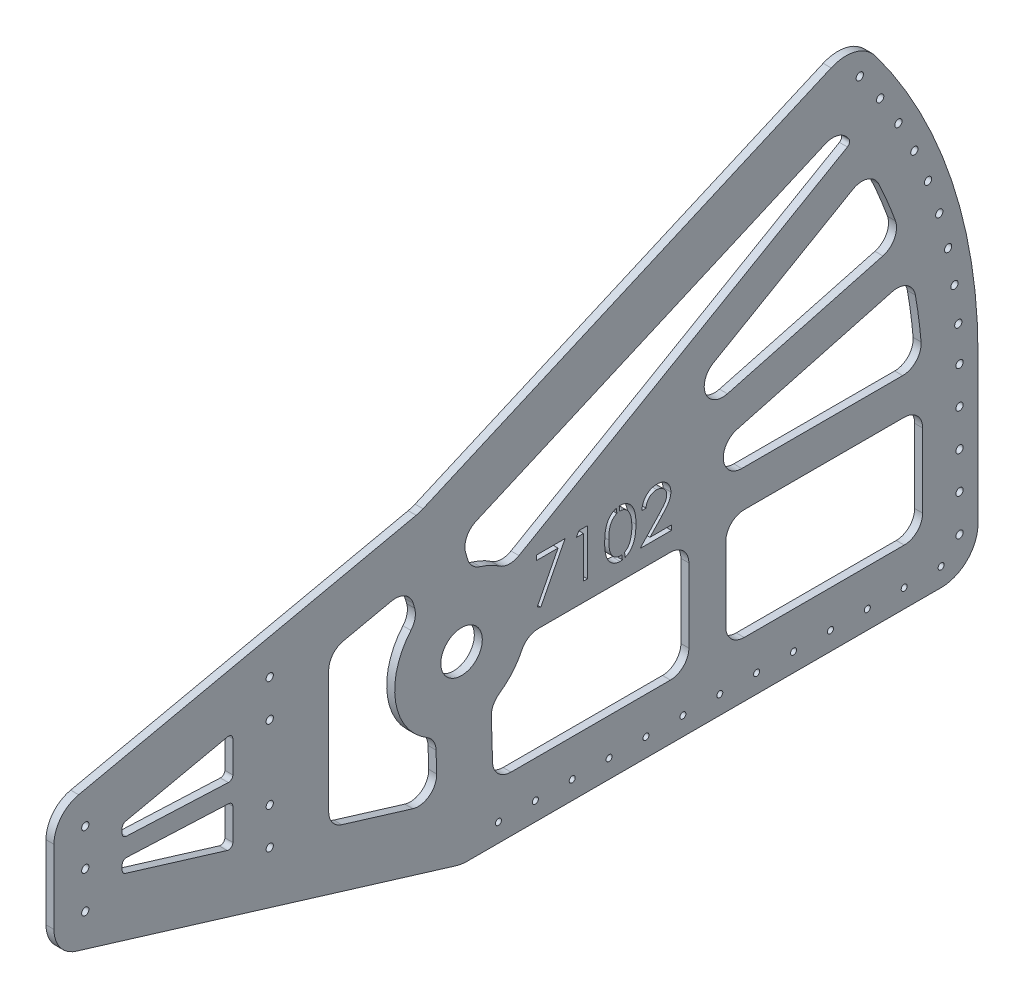
from build123d import *

# Parameters (mm, degrees)
SKETCH1_R               = 46.101
SKETCH1_R_2             = 9.906
SKETCH1_R_3             = 3.96875
SKETCH1_R_4             = 101.6
SKETCH1_R_5             = 14.2875
BOSS_EXTRUDE1_DEPTH     = 2.75
CUT_EXTRUDE1_REACH      = 424.776
SKETCH2_R               = 2.07
CUT_EXTRUDE2_REACH      = 424.776
SKETCH3_R               = 2.5
SKETCH4_R               = 2.5
BOSS_EXTRUDE2_DEPTH     = 5.5
CUT_EXTRUDE3_REACH      = 424.776
SKETCH4_2_R             = 2.5
CUT_EXTRUDE4_REACH      = 424.776
SKETCH5_R               = 2.5
FILLET1_R               = 25.4
CUT_EXTRUDE7_DEPTH      = 420.727841753
FILLET2_R               = 12.7
BOSS_EXTRUDE3_DEPTH     = 5.5
FILLET3_R               = 12.7
FILLET4_R               = 3.000000096
CUT_EXTRUDE8_DEPTH      = 420.727841892
CUT_EXTRUDE8_DEPTH_BACK = 420.727841892
BOSS_EXTRUDE4_DEPTH     = 5.5
SKETCH14_R              = 29.36875
BOSS_EXTRUDE6_DEPTH     = 5.5
CUT_EXTRUDE9_DEPTH      = 420.727841892
CUT_EXTRUDE9_DEPTH_BACK = 420.727841892
FILLET5_R               = 3.000000096


with BuildPart() as part:
    # Sketch1 → Boss-Extrude1 (new, symmetric)
    # profile 1 of 5: a face of its own
    with BuildSketch(Plane(origin=(0, 0, 0), x_dir=(0, 0, -1), z_dir=(1, 0, 0))):
        with Locations((-195.58, 0)):
            Circle(SKETCH1_R)
        with Locations((-195.58, 0)):
            Circle(SKETCH1_R_2, mode=Mode.SUBTRACT)
        with Locations((-195.58, 25.4)):
            Circle(SKETCH1_R_3, mode=Mode.SUBTRACT)
        with Locations((-170.18, 0)):
            Circle(SKETCH1_R_3, mode=Mode.SUBTRACT)
        with Locations((-195.58, -25.4)):
            Circle(SKETCH1_R_3, mode=Mode.SUBTRACT)
        with Locations((-220.98, 0)):
            Circle(SKETCH1_R_3, mode=Mode.SUBTRACT)
    # profile 2 of 5: a face of its own
    with BuildSketch(Plane(origin=(0, 0, 0), x_dir=(0, 0, -1), z_dir=(1, 0, 0))):
        with BuildLine():
            Line((-28.830649351, 97.423578553), (-208.661907143, 44.205948768))
            ThreePointArc((-208.661907143, 44.205948768), (-167.991839498, 36.935018629), (-149.479, 0))
            ThreePointArc((-149.479, 0), (-169.665960898, -38.128267446), (-212.547687379, -42.864901563))
            Line((-212.547687379, -42.864901563), (0, -127))
            Line((0, -127), (304.8, -127))
            ThreePointArc((304.8, -127), (325.816302934, 53.626269144), (248.018149992, 217.988617304))
            Line((248.018149992, 217.988617304), (-28.830649351, 97.423578553))
        make_face()
        with BuildLine():
            ThreePointArc((101.6, 0), (-60.800353724, -81.399490091), (-28.830649351, 97.423578553))
            ThreePointArc((-28.830649351, 97.423578553), (60.800353724, 81.399490091), (101.6, 0))
        make_face(mode=Mode.SUBTRACT)
    # profile 3 of 5: a face of its own
    with BuildSketch(Plane(origin=(0, 0, 0), x_dir=(0, 0, -1), z_dir=(1, 0, 0))):
        Circle(SKETCH1_R_4)
        Circle(SKETCH1_R_5, mode=Mode.SUBTRACT)
    # profile 4 of 5: a face of its own
    with BuildSketch(Plane(origin=(0, 0, 0), x_dir=(0, 0, -1), z_dir=(1, 0, 0))):
        with BuildLine():
            Line((260.222792238, 223.303623795), (248.018149992, 217.988617304))
            ThreePointArc((248.018149992, 217.988617304), (325.816302934, 53.626269144), (304.8, -127))
            Line((304.8, -127), (318.514379581, -127))
            ThreePointArc((318.514379581, -127), (338.248925678, 56.28564895), (260.222792238, 223.303623795))
        make_face()
    # profile 5 of 5: a face of its own
    with BuildSketch(Plane(origin=(0, 0, 0), x_dir=(0, 0, -1), z_dir=(1, 0, 0))):
        with BuildLine():
            Line((272.384654487, 228.6), (260.222792238, 223.303623795))
            ThreePointArc((260.222792238, 223.303623795), (338.248925678, 56.28564895), (318.514379581, -127))
            Line((318.514379581, -127), (355.6, -127))
            Line((355.6, -127), (355.6, 0))
            ThreePointArc((355.6, 0), (334.14917562, 121.637528881), (272.384654487, 228.6))
        make_face()
    extrude(amount=BOSS_EXTRUDE1_DEPTH, both=True)

    # Sketch2 → Cut-Extrude1 (cut, up to next)
    with BuildSketch(Plane(origin=(2.75, 0, 0), x_dir=(0, 0, -1), z_dir=(1, 0, 0)), mode=Mode.PRIVATE) as cut_extrude1_sk1:
        with Locations((330.2, -114.3)):
            Circle(SKETCH2_R)
    cut_extrude1_tool1 = extrude(cut_extrude1_sk1.sketch, amount=-CUT_EXTRUDE1_REACH, mode=Mode.PRIVATE) & part.part
    # Sketch2 → Cut-Extrude1 (cut, up to next)
    with BuildSketch(Plane(origin=(2.75, 0, 0), x_dir=(0, 0, -1), z_dir=(1, 0, 0)), mode=Mode.PRIVATE) as cut_extrude1_sk2:
        with Locations((304.8, -114.3)):
            Circle(SKETCH2_R)
    cut_extrude1_tool2 = extrude(cut_extrude1_sk2.sketch, amount=-CUT_EXTRUDE1_REACH, mode=Mode.PRIVATE) & part.part
    # Sketch2 → Cut-Extrude1 (cut, up to next)
    with BuildSketch(Plane(origin=(2.75, 0, 0), x_dir=(0, 0, -1), z_dir=(1, 0, 0)), mode=Mode.PRIVATE) as cut_extrude1_sk3:
        with Locations((279.4, -114.3)):
            Circle(SKETCH2_R)
    cut_extrude1_tool3 = extrude(cut_extrude1_sk3.sketch, amount=-CUT_EXTRUDE1_REACH, mode=Mode.PRIVATE) & part.part
    # Sketch2 → Cut-Extrude1 (cut, up to next)
    with BuildSketch(Plane(origin=(2.75, 0, 0), x_dir=(0, 0, -1), z_dir=(1, 0, 0)), mode=Mode.PRIVATE) as cut_extrude1_sk4:
        with Locations((254, -114.3)):
            Circle(SKETCH2_R)
    cut_extrude1_tool4 = extrude(cut_extrude1_sk4.sketch, amount=-CUT_EXTRUDE1_REACH, mode=Mode.PRIVATE) & part.part
    # Sketch2 → Cut-Extrude1 (cut, up to next)
    with BuildSketch(Plane(origin=(2.75, 0, 0), x_dir=(0, 0, -1), z_dir=(1, 0, 0)), mode=Mode.PRIVATE) as cut_extrude1_sk5:
        with Locations((228.6, -114.3)):
            Circle(SKETCH2_R)
    cut_extrude1_tool5 = extrude(cut_extrude1_sk5.sketch, amount=-CUT_EXTRUDE1_REACH, mode=Mode.PRIVATE) & part.part
    # Sketch2 → Cut-Extrude1 (cut, up to next)
    with BuildSketch(Plane(origin=(2.75, 0, 0), x_dir=(0, 0, -1), z_dir=(1, 0, 0)), mode=Mode.PRIVATE) as cut_extrude1_sk6:
        with Locations((203.2, -114.3)):
            Circle(SKETCH2_R)
    cut_extrude1_tool6 = extrude(cut_extrude1_sk6.sketch, amount=-CUT_EXTRUDE1_REACH, mode=Mode.PRIVATE) & part.part
    # Sketch2 → Cut-Extrude1 (cut, up to next)
    with BuildSketch(Plane(origin=(2.75, 0, 0), x_dir=(0, 0, -1), z_dir=(1, 0, 0)), mode=Mode.PRIVATE) as cut_extrude1_sk7:
        with Locations((177.8, -114.3)):
            Circle(SKETCH2_R)
    cut_extrude1_tool7 = extrude(cut_extrude1_sk7.sketch, amount=-CUT_EXTRUDE1_REACH, mode=Mode.PRIVATE) & part.part
    # Sketch2 → Cut-Extrude1 (cut, up to next)
    with BuildSketch(Plane(origin=(2.75, 0, 0), x_dir=(0, 0, -1), z_dir=(1, 0, 0)), mode=Mode.PRIVATE) as cut_extrude1_sk8:
        with Locations((152.4, -114.3)):
            Circle(SKETCH2_R)
    cut_extrude1_tool8 = extrude(cut_extrude1_sk8.sketch, amount=-CUT_EXTRUDE1_REACH, mode=Mode.PRIVATE) & part.part
    # Sketch2 → Cut-Extrude1 (cut, up to next)
    with BuildSketch(Plane(origin=(2.75, 0, 0), x_dir=(0, 0, -1), z_dir=(1, 0, 0)), mode=Mode.PRIVATE) as cut_extrude1_sk9:
        with Locations((127, -114.3)):
            Circle(SKETCH2_R)
    cut_extrude1_tool9 = extrude(cut_extrude1_sk9.sketch, amount=-CUT_EXTRUDE1_REACH, mode=Mode.PRIVATE) & part.part
    # Sketch2 → Cut-Extrude1 (cut, up to next)
    with BuildSketch(Plane(origin=(2.75, 0, 0), x_dir=(0, 0, -1), z_dir=(1, 0, 0)), mode=Mode.PRIVATE) as cut_extrude1_sk10:
        with Locations((101.6, -114.3)):
            Circle(SKETCH2_R)
    cut_extrude1_tool10 = extrude(cut_extrude1_sk10.sketch, amount=-CUT_EXTRUDE1_REACH, mode=Mode.PRIVATE) & part.part
    # Sketch2 → Cut-Extrude1 (cut, up to next)
    with BuildSketch(Plane(origin=(2.75, 0, 0), x_dir=(0, 0, -1), z_dir=(1, 0, 0)), mode=Mode.PRIVATE) as cut_extrude1_sk11:
        with Locations((76.2, -114.3)):
            Circle(SKETCH2_R)
    cut_extrude1_tool11 = extrude(cut_extrude1_sk11.sketch, amount=-CUT_EXTRUDE1_REACH, mode=Mode.PRIVATE) & part.part
    # Sketch2 → Cut-Extrude1 (cut, up to next)
    with BuildSketch(Plane(origin=(2.75, 0, 0), x_dir=(0, 0, -1), z_dir=(1, 0, 0)), mode=Mode.PRIVATE) as cut_extrude1_sk12:
        with Locations((50.8, -114.3)):
            Circle(SKETCH2_R)
    cut_extrude1_tool12 = extrude(cut_extrude1_sk12.sketch, amount=-CUT_EXTRUDE1_REACH, mode=Mode.PRIVATE) & part.part
    # Sketch2 → Cut-Extrude1 (cut, up to next)
    with BuildSketch(Plane(origin=(2.75, 0, 0), x_dir=(0, 0, -1), z_dir=(1, 0, 0)), mode=Mode.PRIVATE) as cut_extrude1_sk13:
        with Locations((25.4, -114.3)):
            Circle(SKETCH2_R)
    cut_extrude1_tool13 = extrude(cut_extrude1_sk13.sketch, amount=-CUT_EXTRUDE1_REACH, mode=Mode.PRIVATE) & part.part
    add(cut_extrude1_tool1.solids().sort_by_distance((2.75, -114.3, -330.2))[0], mode=Mode.SUBTRACT)
    add(cut_extrude1_tool2.solids().sort_by_distance((2.75, -114.3, -304.8))[0], mode=Mode.SUBTRACT)
    add(cut_extrude1_tool3.solids().sort_by_distance((2.75, -114.3, -279.4))[0], mode=Mode.SUBTRACT)
    add(cut_extrude1_tool4.solids().sort_by_distance((2.75, -114.3, -254))[0], mode=Mode.SUBTRACT)
    add(cut_extrude1_tool5.solids().sort_by_distance((2.75, -114.3, -228.6))[0], mode=Mode.SUBTRACT)
    add(cut_extrude1_tool6.solids().sort_by_distance((2.75, -114.3, -203.2))[0], mode=Mode.SUBTRACT)
    add(cut_extrude1_tool7.solids().sort_by_distance((2.75, -114.3, -177.8))[0], mode=Mode.SUBTRACT)
    add(cut_extrude1_tool8.solids().sort_by_distance((2.75, -114.3, -152.4))[0], mode=Mode.SUBTRACT)
    add(cut_extrude1_tool9.solids().sort_by_distance((2.75, -114.3, -127))[0], mode=Mode.SUBTRACT)
    add(cut_extrude1_tool10.solids().sort_by_distance((2.75, -114.3, -101.6))[0], mode=Mode.SUBTRACT)
    add(cut_extrude1_tool11.solids().sort_by_distance((2.75, -114.3, -76.2))[0], mode=Mode.SUBTRACT)
    add(cut_extrude1_tool12.solids().sort_by_distance((2.75, -114.3, -50.8))[0], mode=Mode.SUBTRACT)
    add(cut_extrude1_tool13.solids().sort_by_distance((2.75, -114.3, -25.4))[0], mode=Mode.SUBTRACT)

    # Sketch3 → Cut-Extrude2 (cut, up to next)
    with BuildSketch(Plane(origin=(2.75, 0, 0), x_dir=(0, 0, -1), z_dir=(1, 0, 0)), mode=Mode.PRIVATE) as cut_extrude2_sk1:
        with Locations((342.9, 0)):
            Circle(SKETCH3_R)
    cut_extrude2_tool1 = extrude(cut_extrude2_sk1.sketch, amount=-CUT_EXTRUDE2_REACH, mode=Mode.PRIVATE) & part.part
    # Sketch3 → Cut-Extrude2 (cut, up to next)
    with BuildSketch(Plane(origin=(2.75, 0, 0), x_dir=(0, 0, -1), z_dir=(1, 0, 0)), mode=Mode.PRIVATE) as cut_extrude2_sk2:
        with Locations((342.022444467, 24.516473662)):
            Circle(SKETCH3_R)
    cut_extrude2_tool2 = extrude(cut_extrude2_sk2.sketch, amount=-CUT_EXTRUDE2_REACH, mode=Mode.PRIVATE) & part.part
    # Sketch3 → Cut-Extrude2 (cut, up to next)
    with BuildSketch(Plane(origin=(2.75, 0, 0), x_dir=(0, 0, -1), z_dir=(1, 0, 0)), mode=Mode.PRIVATE) as cut_extrude2_sk3:
        with Locations((339.394269578, 48.907461368)):
            Circle(SKETCH3_R)
    cut_extrude2_tool3 = extrude(cut_extrude2_sk3.sketch, amount=-CUT_EXTRUDE2_REACH, mode=Mode.PRIVATE) & part.part
    # Sketch3 → Cut-Extrude2 (cut, up to next)
    with BuildSketch(Plane(origin=(2.75, 0, 0), x_dir=(0, 0, -1), z_dir=(1, 0, 0)), mode=Mode.PRIVATE) as cut_extrude2_sk4:
        with Locations((335.028927474, 73.048119454)):
            Circle(SKETCH3_R)
    cut_extrude2_tool4 = extrude(cut_extrude2_sk4.sketch, amount=-CUT_EXTRUDE2_REACH, mode=Mode.PRIVATE) & part.part
    # Sketch3 → Cut-Extrude2 (cut, up to next)
    with BuildSketch(Plane(origin=(2.75, 0, 0), x_dir=(0, 0, -1), z_dir=(1, 0, 0)), mode=Mode.PRIVATE) as cut_extrude2_sk5:
        with Locations((328.94876187, 96.814885551)):
            Circle(SKETCH3_R)
    cut_extrude2_tool5 = extrude(cut_extrude2_sk5.sketch, amount=-CUT_EXTRUDE2_REACH, mode=Mode.PRIVATE) & part.part
    # Sketch3 → Cut-Extrude2 (cut, up to next)
    with BuildSketch(Plane(origin=(2.75, 0, 0), x_dir=(0, 0, -1), z_dir=(1, 0, 0)), mode=Mode.PRIVATE) as cut_extrude2_sk6:
        with Locations((321.184893693, 120.086111034)):
            Circle(SKETCH3_R)
    cut_extrude2_tool6 = extrude(cut_extrude2_sk6.sketch, amount=-CUT_EXTRUDE2_REACH, mode=Mode.PRIVATE) & part.part
    # Sketch3 → Cut-Extrude2 (cut, up to next)
    with BuildSketch(Plane(origin=(2.75, 0, 0), x_dir=(0, 0, -1), z_dir=(1, 0, 0)), mode=Mode.PRIVATE) as cut_extrude2_sk7:
        with Locations((311.777061792, 142.742683666)):
            Circle(SKETCH3_R)
    cut_extrude2_tool7 = extrude(cut_extrude2_sk7.sketch, amount=-CUT_EXTRUDE2_REACH, mode=Mode.PRIVATE) & part.part
    # Sketch3 → Cut-Extrude2 (cut, up to next)
    with BuildSketch(Plane(origin=(2.75, 0, 0), x_dir=(0, 0, -1), z_dir=(1, 0, 0)), mode=Mode.PRIVATE) as cut_extrude2_sk8:
        with Locations((300.773419535, 164.668637273)):
            Circle(SKETCH3_R)
    cut_extrude2_tool8 = extrude(cut_extrude2_sk8.sketch, amount=-CUT_EXTRUDE2_REACH, mode=Mode.PRIVATE) & part.part
    # Sketch3 → Cut-Extrude2 (cut, up to next)
    with BuildSketch(Plane(origin=(2.75, 0, 0), x_dir=(0, 0, -1), z_dir=(1, 0, 0)), mode=Mode.PRIVATE) as cut_extrude2_sk9:
        with Locations((288.230288339, 185.751745306)):
            Circle(SKETCH3_R)
    cut_extrude2_tool9 = extrude(cut_extrude2_sk9.sketch, amount=-CUT_EXTRUDE2_REACH, mode=Mode.PRIVATE) & part.part
    # Sketch3 → Cut-Extrude2 (cut, up to next)
    with BuildSketch(Plane(origin=(2.75, 0, 0), x_dir=(0, 0, -1), z_dir=(1, 0, 0)), mode=Mode.PRIVATE) as cut_extrude2_sk10:
        with Locations((274.211869395, 205.884095264)):
            Circle(SKETCH3_R)
    cut_extrude2_tool10 = extrude(cut_extrude2_sk10.sketch, amount=-CUT_EXTRUDE2_REACH, mode=Mode.PRIVATE) & part.part
    # Sketch3 → Cut-Extrude2 (cut, up to next)
    with BuildSketch(Plane(origin=(2.75, 0, 0), x_dir=(0, 0, -1), z_dir=(1, 0, 0)), mode=Mode.PRIVATE) as cut_extrude2_sk11:
        with Locations((342.9, -25.4)):
            Circle(SKETCH3_R)
    cut_extrude2_tool11 = extrude(cut_extrude2_sk11.sketch, amount=-CUT_EXTRUDE2_REACH, mode=Mode.PRIVATE) & part.part
    # Sketch3 → Cut-Extrude2 (cut, up to next)
    with BuildSketch(Plane(origin=(2.75, 0, 0), x_dir=(0, 0, -1), z_dir=(1, 0, 0)), mode=Mode.PRIVATE) as cut_extrude2_sk12:
        with Locations((342.9, -50.8)):
            Circle(SKETCH3_R)
    cut_extrude2_tool12 = extrude(cut_extrude2_sk12.sketch, amount=-CUT_EXTRUDE2_REACH, mode=Mode.PRIVATE) & part.part
    # Sketch3 → Cut-Extrude2 (cut, up to next)
    with BuildSketch(Plane(origin=(2.75, 0, 0), x_dir=(0, 0, -1), z_dir=(1, 0, 0)), mode=Mode.PRIVATE) as cut_extrude2_sk13:
        with Locations((342.9, -76.2)):
            Circle(SKETCH3_R)
    cut_extrude2_tool13 = extrude(cut_extrude2_sk13.sketch, amount=-CUT_EXTRUDE2_REACH, mode=Mode.PRIVATE) & part.part
    # Sketch3 → Cut-Extrude2 (cut, up to next)
    with BuildSketch(Plane(origin=(2.75, 0, 0), x_dir=(0, 0, -1), z_dir=(1, 0, 0)), mode=Mode.PRIVATE) as cut_extrude2_sk14:
        with Locations((342.9, -101.6)):
            Circle(SKETCH3_R)
    cut_extrude2_tool14 = extrude(cut_extrude2_sk14.sketch, amount=-CUT_EXTRUDE2_REACH, mode=Mode.PRIVATE) & part.part
    add(cut_extrude2_tool1.solids().sort_by_distance((2.75, 0, -342.9))[0], mode=Mode.SUBTRACT)
    add(cut_extrude2_tool2.solids().sort_by_distance((2.75, 24.516474, -342.022444))[0], mode=Mode.SUBTRACT)
    add(cut_extrude2_tool3.solids().sort_by_distance((2.75, 48.907461, -339.39427))[0], mode=Mode.SUBTRACT)
    add(cut_extrude2_tool4.solids().sort_by_distance((2.75, 73.048119, -335.028927))[0], mode=Mode.SUBTRACT)
    add(cut_extrude2_tool5.solids().sort_by_distance((2.75, 96.814886, -328.948762))[0], mode=Mode.SUBTRACT)
    add(cut_extrude2_tool6.solids().sort_by_distance((2.75, 120.086111, -321.184894))[0], mode=Mode.SUBTRACT)
    add(cut_extrude2_tool7.solids().sort_by_distance((2.75, 142.742684, -311.777062))[0], mode=Mode.SUBTRACT)
    add(cut_extrude2_tool8.solids().sort_by_distance((2.75, 164.668637, -300.77342))[0], mode=Mode.SUBTRACT)
    add(cut_extrude2_tool9.solids().sort_by_distance((2.75, 185.751745, -288.230288))[0], mode=Mode.SUBTRACT)
    add(cut_extrude2_tool10.solids().sort_by_distance((2.75, 205.884095, -274.211869))[0], mode=Mode.SUBTRACT)
    add(cut_extrude2_tool11.solids().sort_by_distance((2.75, -25.4, -342.9))[0], mode=Mode.SUBTRACT)
    add(cut_extrude2_tool12.solids().sort_by_distance((2.75, -50.8, -342.9))[0], mode=Mode.SUBTRACT)
    add(cut_extrude2_tool13.solids().sort_by_distance((2.75, -76.2, -342.9))[0], mode=Mode.SUBTRACT)
    add(cut_extrude2_tool14.solids().sort_by_distance((2.75, -101.6, -342.9))[0], mode=Mode.SUBTRACT)

    # Sketch4 → Boss-Extrude2 (add)
    # profile 1 of 4: a face of its own
    with BuildSketch(Plane(origin=(2.75, 0, 0), x_dir=(0, 0, -1), z_dir=(1, 0, 0))):
        with Locations((-132.08, 25.4)):
            Circle(SKETCH4_R)
    # profile 2 of 4: a face of its own
    with BuildSketch(Plane(origin=(2.75, 0, 0), x_dir=(0, 0, -1), z_dir=(1, 0, 0))):
        with Locations((-132.08, -25.4)):
            Circle(SKETCH4_R)
    # profile 3 of 4: a face of its own
    with BuildSketch(Plane(origin=(2.75, 0, 0), x_dir=(0, 0, -1), z_dir=(1, 0, 0))):
        with Locations((-132.08, 0)):
            Circle(SKETCH4_R)
    # profile 4 of 4: a face of its own
    with BuildSketch(Plane(origin=(2.75, 0, 0), x_dir=(0, 0, -1), z_dir=(1, 0, 0))):
        with BuildLine():
            Line((-280.63, 25.4), (-280.63, -25.4))
            ThreePointArc((-280.63, -25.4), (-276.399947897, -38.222710511), (-265.370426464, -46.011478232))
            Line((-265.370426464, -46.011478232), (0, -127))
            Line((0, -127), (-195.58, -49.581408647))
            Line((-195.58, -49.581408647), (-212.547687379, -42.864901563))
            ThreePointArc((-212.547687379, -42.864901563), (-241.635160157, 2.05534034), (-208.661907143, 44.205948768))
            Line((-208.661907143, 44.205948768), (-28.830649351, 97.423578553))
            Line((-28.830649351, 97.423578553), (-263.650668099, 46.45971256))
            ThreePointArc((-263.650668099, 46.45971256), (-275.856477544, 38.925986146), (-280.63, 25.4))
        make_face()
        with Locations((-259.08, -25.4)):
            Circle(SKETCH4_R, mode=Mode.SUBTRACT)
        with Locations((-259.08, 0)):
            Circle(SKETCH4_R, mode=Mode.SUBTRACT)
        with Locations((-259.08, 25.4)):
            Circle(SKETCH4_R, mode=Mode.SUBTRACT)
    extrude(amount=-BOSS_EXTRUDE2_DEPTH)

    # Sketch4<2> → Cut-Extrude3 (cut, up to next)
    with BuildSketch(Plane(origin=(2.75, 0, 0), x_dir=(0, 0, -1), z_dir=(1, 0, 0)), mode=Mode.PRIVATE) as cut_extrude3_sk1:
        with Locations((-132.08, 25.4)):
            Circle(SKETCH4_2_R)
    cut_extrude3_tool1 = extrude(cut_extrude3_sk1.sketch, amount=-CUT_EXTRUDE3_REACH, mode=Mode.PRIVATE) & part.part
    # Sketch4<2> → Cut-Extrude3 (cut, up to next)
    with BuildSketch(Plane(origin=(2.75, 0, 0), x_dir=(0, 0, -1), z_dir=(1, 0, 0)), mode=Mode.PRIVATE) as cut_extrude3_sk2:
        with Locations((-132.08, -25.4)):
            Circle(SKETCH4_2_R)
    cut_extrude3_tool2 = extrude(cut_extrude3_sk2.sketch, amount=-CUT_EXTRUDE3_REACH, mode=Mode.PRIVATE) & part.part
    add(cut_extrude3_tool1.solids().sort_by_distance((2.75, 25.4, 132.08))[0], mode=Mode.SUBTRACT)
    add(cut_extrude3_tool2.solids().sort_by_distance((2.75, -25.4, 132.08))[0], mode=Mode.SUBTRACT)

    # Sketch5 → Cut-Extrude4 (cut, up to next)
    with BuildSketch(Plane(origin=(2.75, 0, 0), x_dir=(0, 0, -1), z_dir=(1, 0, 0)), mode=Mode.PRIVATE) as cut_extrude4_sk1:
        with Locations((-132.08, 50.8)):
            Circle(SKETCH5_R)
    cut_extrude4_tool1 = extrude(cut_extrude4_sk1.sketch, amount=-CUT_EXTRUDE4_REACH, mode=Mode.PRIVATE) & part.part
    # Sketch5 → Cut-Extrude4 (cut, up to next)
    with BuildSketch(Plane(origin=(2.75, 0, 0), x_dir=(0, 0, -1), z_dir=(1, 0, 0)), mode=Mode.PRIVATE) as cut_extrude4_sk2:
        with Locations((-132.08, -50.8)):
            Circle(SKETCH5_R)
    cut_extrude4_tool2 = extrude(cut_extrude4_sk2.sketch, amount=-CUT_EXTRUDE4_REACH, mode=Mode.PRIVATE) & part.part
    add(cut_extrude4_tool1.solids().sort_by_distance((2.75, 50.8, 132.08))[0], mode=Mode.SUBTRACT)
    add(cut_extrude4_tool2.solids().sort_by_distance((2.75, -50.8, 132.08))[0], mode=Mode.SUBTRACT)

    # Fillet1
    fillet1_edges = [part.edges().sort_by_distance(p)[0] for p in [
        (0, 97.423578553, 28.830649351),
        (0, 228.6, -272.384654487),
        (0, -127, -355.6),
        (0, -127, 0),
    ]]
    fillet(fillet1_edges, radius=FILLET1_R)

    # Sketch9 → Cut-Extrude7 (cut, through all)
    with BuildSketch(Plane(origin=(2.75, 0, 0), x_dir=(0, 0, -1), z_dir=(1, 0, 0))):
        with BuildLine():
            Line((-36.659058041, 56.737550412), (-91.48, 44.839556559))
            Line((-91.48, 44.839556559), (-91.48, -50.8))
            ThreePointArc((-91.48, -50.8), (-91.689277233, -54.916978794), (-92.314951448, -58.991514734))
            Line((-92.314951448, -58.991514734), (-16.608750645, -82.096324767))
            Line((-16.608750645, -82.096324767), (-17.791463794, -42.460749196))
            ThreePointArc((-17.791463794, -42.460749196), (-45.458317088, -7.279616318), (-30.160941514, 34.781733902))
            Line((-30.160941514, 34.781733902), (-36.659058041, 56.737550412))
        make_face()
        with BuildLine():
            Line((-0.340030447, 68.2748581), (6.372578275, 45.594316009))
            ThreePointArc((6.372578275, 45.594316009), (45.458317088, 7.279616318), (20.291585274, -41.324362951))
            Line((20.291585274, -41.324362951), (21.711227368, -88.9))
            Line((21.711227368, -88.9), (317.5, -88.9))
            Line((317.5, -88.9), (317.5, 0))
            ThreePointArc((317.5, 0), (302.864823942, 95.284565478), (260.308513901, 181.784838727))
            Line((260.308513901, 181.784838727), (-0.340030447, 68.2748581))
        make_face()
    extrude(amount=-CUT_EXTRUDE7_DEPTH, mode=Mode.SUBTRACT)

    # Fillet2
    fillet2_edges = [part.edges().sort_by_distance(p)[0] for p in [
        (0, -88.9, -317.5),
        (0, -88.9, -21.711227368),
        (0, -41.324362951, -20.291585274),
        (0, 45.594316009, -6.372578275),
        (0, 68.2748581, 0.340030447),
        (0, 181.784838727, -260.308513901),
        (0, 44.839556559, 91.48),
        (0, 56.737550412, 36.659058041),
        (0, 34.781733902, 30.160941514),
        (0, -42.460749196, 17.791463794),
        (0, -82.096324767, 16.608750645),
        (0, -58.991514734, 92.314951448),
    ]]
    fillet(fillet2_edges, radius=FILLET2_R)

    # Sketch10 → Boss-Extrude3 (add)
    with BuildSketch(Plane(origin=(2.75, 0, 0), x_dir=(0, 0, -1), z_dir=(1, 0, 0))):
        with BuildLine():
            Line((96.466077232, 12.7), (309.723008343, 69.842022472))
            ThreePointArc((309.723008343, 69.842022472), (306.681449847, 82.17504682), (303.149004597, 94.376538459))
            Line((303.149004597, 94.376538459), (89.892073486, 37.234515988))
            Line((89.892073486, 37.234515988), (281.09300719, 147.624426531))
            ThreePointArc((281.09300719, 147.624426531), (274.963065702, 158.75), (268.39300719, 169.621471787))
            Line((268.39300719, 169.621471787), (31.972591962, 33.124081413))
            ThreePointArc((31.972591962, 33.124081413), (44.468810228, 11.915381789), (44.251117571, -12.7))
            Line((44.251117571, -12.7), (156.514755049, -12.7))
            Line((156.514755049, -12.7), (156.514755049, -88.9))
            Line((156.514755049, -88.9), (181.914755049, -88.9))
            Line((181.914755049, -88.9), (181.914755049, -12.7))
            Line((181.914755049, -12.7), (317.5, -12.7))
            Line((317.5, -12.7), (317.5, 0))
            ThreePointArc((317.5, 0), (317.436468223, 6.35127089), (317.245898319, 12.7))
            Line((317.245898319, 12.7), (96.466077232, 12.7))
        make_face()
    extrude(amount=-BOSS_EXTRUDE3_DEPTH)

    # Fillet3
    fillet3_edges = [part.edges().sort_by_distance(p)[0] for p in [
        (0, -12.7, -44.251117571),
        (0, 33.124081413, -31.972591962),
        (0, 147.624426531, -281.09300719),
        (0, 37.234515988, -89.892073486),
        (0, 94.376538459, -303.149004597),
        (0, 69.842022472, -309.723008343),
        (0, 12.7, -96.466077232),
        (0, 12.7, -317.245898319),
        (0, -12.7, -317.5),
        (0, -12.7, -181.914755049),
        (0, -88.9, -181.914755049),
        (0, -88.9, -156.514755049),
        (0, -12.7, -156.514755049),
    ]]
    fillet(fillet3_edges, radius=FILLET3_R)

    # Fillet4
    fillet4_edges = [part.edges().sort_by_distance(p)[0] for p in [
        (0, 169.621471787, -268.39300719),
    ]]
    fillet(fillet4_edges, radius=FILLET4_R)

    # Sketch11 → Cut-Extrude8 (cut, two sides: drawn at the far end of the back side and taken through both)
    # profile 1 of 4: a face of its own
    with BuildSketch(Plane(origin=(2.75, 0, 0), x_dir=(0, 0, -1), z_dir=(1, 0, 0)).offset(-CUT_EXTRUDE8_DEPTH_BACK)):
        Polygon((51.724408772, 31.75), (71.262870311, 31.75), (54.573767747, -0.814102564), (52.112379525, 0.540614984), (66.441856689, 28.493589744), (51.724408772, 28.493589744), align=None)
    # profile 2 of 4: a face of its own
    with BuildSketch(Plane(origin=(2.75, 0, 0), x_dir=(0, 0, -1), z_dir=(1, 0, 0)).offset(-CUT_EXTRUDE8_DEPTH_BACK)):
        Polygon((80.86037632, 31.75), (86.730819029, 31.75), (86.730819029, 0), (83.881460054, 0), (83.881460054, 28.493589744), (78.99684467, 28.493589744), align=None)
    # profile 3 of 4: a face of its own
    with BuildSketch(Plane(origin=(2.75, 0, 0), x_dir=(0, 0, -1), z_dir=(1, 0, 0)).offset(-CUT_EXTRUDE8_DEPTH_BACK)):
        with BuildLine():
            add(Edge.make_bspline(
                [(98.535306208, 15.862279647), (98.538281801, 16.371163093), (98.544061934, 17.359676522), (98.608364038, 18.800080061), (98.715183215, 20.151362682), (98.86157224, 21.413589067), (99.039716775, 22.587085074), (99.277528689, 23.668714656), (99.547973399, 24.663483945), (99.861413443, 25.574636813), (100.215088386, 26.414448833), (100.600027751, 27.198448874), (101.031508386, 27.925450689), (101.484870382, 28.607057787), (101.978465603, 29.232112733), (102.498247488, 29.8094426), (103.06450308, 30.325704408), (103.657983227, 30.796024437), (104.284061154, 31.208316073), (104.924891054, 31.571470201), (105.5848838, 31.881711854), (106.265841316, 32.125646523), (106.961643091, 32.327130633), (107.674721482, 32.464916086), (108.406253855, 32.551610899), (108.900024727, 32.559899171), (109.150440423, 32.564102564)],
                knots=[0, 0, 0, 0, 1.646270934, 3.197905019, 4.663502075, 6.030701355, 7.308322542, 8.50163776, 9.611534131, 10.641858119, 11.616356847, 12.558055219, 13.465016945, 14.349605745, 15.204443733, 16.039544428, 16.859896111, 17.680448484, 18.487036065, 19.28249412, 20.06191084, 20.843045899, 21.620316918, 22.403196591, 23.190181807, 24, 24, 24, 24], degree=3))
            add(Edge.make_bspline(
                [(109.150440423, 32.564102564), (109.402947978, 32.559677384), (109.905106058, 32.550877092), (110.647515177, 32.466295613), (111.372773004, 32.325950425), (112.077787548, 32.12709587), (112.768349925, 31.880392232), (113.439058766, 31.571173384), (114.094080149, 31.211229373), (114.7230049, 30.7882842), (115.332737482, 30.316730694), (115.908301146, 29.783669342), (116.449748283, 29.194482603), (116.963874267, 28.555474266), (117.436092899, 27.854388139), (117.885794749, 27.103418), (118.288312503, 26.28943087), (118.675977056, 25.426008054), (119.010594722, 24.489259149), (119.312367089, 23.484464536), (119.556197733, 22.399755841), (119.759300418, 21.240824187), (119.916643402, 20.003413446), (120.031239513, 18.690176156), (120.091773927, 17.300248326), (120.103174002, 16.34994498), (120.109024157, 15.862279647)],
                knots=[0, 0, 0, 0, 0.810914788, 1.612654377, 2.396697861, 3.181598691, 3.963628158, 4.749916497, 5.551656086, 6.361998678, 7.18212741, 8.025565596, 8.878627764, 9.750805457, 10.657531673, 11.591944965, 12.560506719, 13.57287815, 14.630710178, 15.753379473, 16.941251878, 18.199788006, 19.531962791, 20.947069417, 22.433333509, 24, 24, 24, 24], degree=3))
            add(Edge.make_bspline(
                [(120.109024157, 15.862279647), (120.103113354, 15.37674134), (120.091596396, 14.430689748), (120.031918128, 13.0470159), (119.914364831, 11.740747936), (119.767317079, 10.508753027), (119.563654772, 9.356158913), (119.313236479, 8.27897713), (119.035194264, 7.272555909), (118.691978632, 6.345140118), (118.316324331, 5.483792346), (117.907609337, 4.679454643), (117.469733058, 3.92501756), (116.992678014, 3.226519856), (116.48419348, 2.579013466), (115.933396396, 1.993927889), (115.355813231, 1.457165365), (114.744286316, 0.979539888), (114.105552958, 0.561484874), (113.452781332, 0.187616374), (112.774389212, -0.113851645), (112.085750283, -0.372705231), (111.377014391, -0.570466473), (110.649064989, -0.707207877), (109.905604849, -0.803109645), (109.403033509, -0.81042557), (109.150440423, -0.814102564)],
                knots=[0, 0, 0, 0, 1.561518951, 3.042555995, 4.452378317, 5.7783523, 7.031515105, 8.214008947, 9.334062868, 10.386615937, 11.391082383, 12.354592575, 13.286541444, 14.194233754, 15.072674879, 15.931287219, 16.775624067, 17.606195743, 18.42308326, 19.229000347, 20.022332153, 20.807536673, 21.593273796, 22.3848459, 23.188221202, 24, 24, 24, 24], degree=3))
            add(Edge.make_bspline(
                [(109.150440423, -0.814102564), (108.900031674, -0.809872054), (108.4062745, -0.801530313), (107.674641783, -0.715227178), (106.964508189, -0.576475113), (106.272369492, -0.382195919), (105.594674677, -0.144389904), (104.940658362, 0.165432798), (104.30304866, 0.522248995), (103.683546687, 0.928607461), (103.093793512, 1.394168443), (102.53047045, 1.909101633), (102.007729205, 2.486256865), (101.521191338, 3.116520881), (101.058783538, 3.794095294), (100.633429937, 4.528231249), (100.239994332, 5.316017787), (99.880371238, 6.162544549), (99.561522648, 7.080164251), (99.279875581, 8.079374656), (99.057497153, 9.16899507), (98.867151772, 10.340274043), (98.71362344, 11.598244697), (98.608809203, 12.94358997), (98.544027274, 14.375471508), (98.538266278, 15.357633033), (98.535306208, 15.862279647)],
                knots=[0, 0, 0, 0, 0.810891512, 1.598919785, 2.382837074, 3.152667961, 3.926044502, 4.706494248, 5.493654104, 6.291793342, 7.103789334, 7.925228297, 8.761435821, 9.622817696, 10.50288917, 11.416980706, 12.369136599, 13.353924996, 14.394355917, 15.514179734, 16.714354668, 17.994756427, 19.357759367, 20.818452758, 22.365282078, 24, 24, 24, 24], degree=3))
        make_face()
        with BuildLine():
            add(Edge.make_bspline(
                [(101.384665182, 15.875), (101.385748738, 15.450922518), (101.387851706, 14.627871397), (101.442790097, 13.431864673), (101.517631488, 12.316348118), (101.614163255, 11.279905323), (101.757518574, 10.326044496), (101.918144435, 9.448205228), (102.113616391, 8.651033148), (102.344892624, 7.929058008), (102.608318717, 7.270027173), (102.895936195, 6.656787578), (103.20491561, 6.082095012), (103.550710761, 5.551111565), (103.927311692, 5.062105648), (104.326211971, 4.606422097), (104.762298985, 4.200049481), (105.365582936, 3.712670153), (106.162022382, 3.209032297), (107.16550794, 2.770464197), (108.196643174, 2.494851913), (108.896515229, 2.459802127), (109.245843067, 2.442307692)],
                knots=[0, 0, 0, 0, 1.459021318, 2.831673884, 4.118529203, 5.306027144, 6.411944654, 7.436330062, 8.375795394, 9.233974572, 10.042671642, 10.816086306, 11.563610507, 12.285937304, 12.993564865, 13.685989202, 14.367179055, 15.041617293, 16.353048772, 17.594441528, 18.799311195, 20, 20, 20, 20], degree=3))
            add(Edge.make_bspline(
                [(109.245843067, 2.442307692), (109.597430517, 2.456801847), (110.29987952, 2.485760231), (111.326164662, 2.765148777), (112.322482112, 3.186693885), (113.10327757, 3.685146256), (113.697297786, 4.159838958), (114.122901911, 4.564557554), (114.513536207, 5.017728636), (114.884032172, 5.506672249), (115.223839501, 6.040729784), (115.532840822, 6.617333145), (115.814811189, 7.238083545), (115.975457534, 7.671423321), (116.057591865, 7.892978766)],
                knots=[0, 0, 0, 0, 1.353760809, 2.704726607, 4.075137775, 5.516104923, 6.260822281, 7.007110065, 7.778089737, 8.566572457, 9.372053459, 10.217411131, 11.088608312, 12, 12, 12, 12], degree=3))
            add(Edge.make_bspline(
                [(116.057591865, 7.892978766), (116.153311473, 8.176277117), (116.347663327, 8.751494264), (116.598141565, 9.643793108), (116.795403401, 10.579989609), (116.972871076, 11.554488882), (117.094002368, 12.574477599), (117.191500389, 13.636799796), (117.248928763, 14.742256439), (117.256047577, 15.493325287), (117.259665182, 15.875)],
                knots=[0, 0, 0, 0, 0.884706709, 1.796334032, 2.740027952, 3.714592787, 4.726048262, 5.777819803, 6.87074269, 8, 8, 8, 8], degree=3))
            add(Edge.make_bspline(
                [(117.259665182, 15.875), (117.25467418, 16.256612979), (117.244910713, 17.003129545), (117.207590967, 18.096401613), (117.11121997, 19.13478773), (117.004185106, 20.122761303), (116.846367457, 21.054853335), (116.676207352, 21.938866818), (116.447596355, 22.763849972), (116.203395539, 23.542719035), (115.923901237, 24.266624972), (115.616237076, 24.938942891), (115.287653979, 25.562918608), (114.930763654, 26.13684015), (114.549802815, 26.663278218), (114.134716476, 27.131677754), (113.701969666, 27.556555965), (113.095842337, 28.041537842), (112.302325565, 28.536036794), (111.31494005, 28.991111901), (110.287413491, 29.25244427), (109.592782872, 29.289289574), (109.245843067, 29.307692308)],
                knots=[0, 0, 0, 0, 1.31362396, 2.569729283, 3.763502607, 4.902122613, 5.988968491, 7.01645872, 7.998833611, 8.933434873, 9.825090667, 10.667526885, 11.477055099, 12.250526234, 12.991942729, 13.710640831, 14.402115721, 15.076753259, 16.378508321, 17.609869233, 18.806226677, 20, 20, 20, 20], degree=3))
            add(Edge.make_bspline(
                [(109.245843067, 29.307692308), (108.894682696, 29.289264185), (108.191722224, 29.252374367), (107.153515777, 28.992085566), (106.158340587, 28.538396518), (105.366922174, 28.039899996), (104.760372111, 27.565116743), (104.333264821, 27.153396766), (103.932795973, 26.703034316), (103.563881836, 26.209531231), (103.218357624, 25.679166828), (102.901029867, 25.107768748), (102.615122662, 24.492441372), (102.35128437, 23.833706565), (102.11930265, 23.111793712), (101.927950269, 22.315603556), (101.751174859, 21.440556395), (101.626032062, 20.48152943), (101.514782278, 19.444827039), (101.443287193, 18.326525652), (101.387667929, 17.128513058), (101.385686145, 16.301206406), (101.384665182, 15.875)],
                knots=[0, 0, 0, 0, 1.207732386, 2.417664972, 3.655092373, 4.956220595, 5.625982001, 6.301752483, 6.994047911, 7.697131622, 8.419323945, 9.170223765, 9.943494443, 10.752040957, 11.610060368, 12.549350801, 13.567764191, 14.679664412, 15.874934091, 17.154273443, 18.533957287, 20, 20, 20, 20], degree=3))
        make_face(mode=Mode.SUBTRACT)
    # profile 4 of 4: a face of its own
    with BuildSketch(Plane(origin=(2.75, 0, 0), x_dir=(0, 0, -1), z_dir=(1, 0, 0)).offset(-CUT_EXTRUDE8_DEPTH_BACK)):
        with BuildLine():
            Line((127.028895952, 21.980769231), (124.179536977, 21.980769231))
            add(Edge.make_bspline(
                [(124.179536977, 21.980769231), (124.19810758, 22.358783713), (124.234579748, 23.101194095), (124.405379229, 24.183632389), (124.649771473, 25.218272349), (124.995315377, 26.196806568), (125.424450897, 27.127887177), (125.939073288, 28.00781589), (126.548617503, 28.833235959), (127.239921448, 29.596495466), (127.990751245, 30.296697002), (128.800883696, 30.901355276), (129.652192158, 31.412237009), (130.542093848, 31.839331131), (131.480628961, 32.159914019), (132.4592806, 32.39778175), (133.48234848, 32.540895743), (134.179397251, 32.556278941), (134.533903964, 32.564102564)],
                knots=[0, 0, 0, 0, 1.10065271, 2.161652631, 3.183658789, 4.190468796, 5.17591951, 6.163126047, 7.15150782, 8.156236427, 9.156009102, 10.134482811, 11.092018607, 12.041330605, 13.001268258, 13.972401359, 14.968799086, 16, 16, 16, 16], degree=3))
            add(Edge.make_bspline(
                [(134.533903964, 32.564102564), (134.882047922, 32.555952281), (135.566138363, 32.539937265), (136.564558066, 32.402405071), (137.515037808, 32.186998632), (138.41571969, 31.884780213), (139.259417562, 31.478521479), (140.052469466, 30.990500949), (140.804316821, 30.426078193), (141.481106929, 29.761561457), (142.102573077, 29.052154112), (142.638714963, 28.294799558), (143.09784866, 27.512576752), (143.480551185, 26.699520923), (143.762274731, 25.847976594), (143.976162761, 24.970341255), (144.097061442, 24.057530469), (144.115616355, 23.439706714), (144.125049798, 23.125600962)],
                knots=[0, 0, 0, 0, 1.111607364, 2.184268762, 3.212621178, 4.221274766, 5.211760367, 6.196651075, 7.1921475, 8.207485113, 9.220403448, 10.201281604, 11.166441695, 12.114753415, 13.065576456, 14.026450734, 14.996634279, 16, 16, 16, 16], degree=3))
            add(Edge.make_bspline(
                [(144.125049798, 23.125600962), (144.109689485, 22.683388462), (144.07923841, 21.806723667), (143.818757994, 20.518445983), (143.411936072, 19.27027711), (142.922102907, 18.265731584), (142.427960021, 17.456256319), (141.982666202, 16.78979021), (141.461378274, 16.072190604), (140.856509042, 15.305860472), (140.180570845, 14.484797262), (139.42744122, 13.609496975), (138.591749633, 12.689003063), (138.005204662, 12.06030225), (137.701271753, 11.73452524)],
                knots=[0, 0, 0, 0, 1.184426356, 2.348067706, 3.509069118, 4.696110526, 5.333549288, 6.050745305, 6.844228056, 7.710549037, 8.667450064, 9.695053472, 10.805634456, 12, 12, 12, 12], degree=3))
            Line((137.701271753, 11.73452524), (129.757411577, 3.256410256))
            Line((129.757411577, 3.256410256), (144.53210108, 3.256410256))
            Line((144.53210108, 3.256410256), (144.53210108, 0))
            Line((144.53210108, 0), (122.958383131, 0))
            Line((122.958383131, 0), (135.271684413, 13.140124199))
            add(Edge.make_bspline(
                [(135.271684413, 13.140124199), (135.571475958, 13.453073122), (136.147314161, 14.054183958), (136.961770393, 14.931780811), (137.693281216, 15.745937359), (138.34658185, 16.495115334), (138.907500078, 17.190273128), (139.40526961, 17.80889651), (139.804100329, 18.378169024), (140.236947132, 19.038030307), (140.656173963, 19.843684899), (141.016421765, 20.828240508), (141.236085033, 21.8417663), (141.262436041, 22.526677637), (141.275690823, 22.87119391)],
                knots=[0, 0, 0, 0, 1.329631726, 2.553950428, 3.673215718, 4.687767853, 5.603093632, 6.413772471, 7.123043292, 7.734684054, 8.834405432, 9.900288307, 10.943827018, 12, 12, 12, 12], degree=3))
            add(Edge.make_bspline(
                [(141.275690823, 22.87119391), (141.269923733, 23.08783231), (141.258557904, 23.514784996), (141.158248791, 24.14076581), (141.006660629, 24.744603763), (140.789442931, 25.328156237), (140.502724645, 25.885556081), (140.153716128, 26.417481794), (139.751034838, 26.931731692), (139.285205466, 27.413908039), (138.773472394, 27.855516117), (138.232867415, 28.246713178), (137.660912898, 28.573639397), (137.060020361, 28.841641122), (136.431865032, 29.051874937), (135.775231987, 29.197549193), (135.091935553, 29.289011726), (134.625360271, 29.301386714), (134.38761991, 29.307692308)],
                knots=[0, 0, 0, 0, 0.991446411, 1.95395049, 2.89581595, 3.838931463, 4.798493298, 5.75982156, 6.748411868, 7.785213223, 8.824556874, 9.840280684, 10.836137867, 11.835679398, 12.848801643, 13.863922112, 14.911575587, 16, 16, 16, 16], degree=3))
            add(Edge.make_bspline(
                [(134.38761991, 29.307692308), (134.139327356, 29.301205944), (133.651721776, 29.288467795), (132.935813405, 29.199362201), (132.252863852, 29.04563922), (131.601155161, 28.835393674), (130.979584633, 28.568162552), (130.39117509, 28.235316011), (129.837247452, 27.83813718), (129.316760419, 27.38782642), (128.837208609, 26.886470323), (128.415869092, 26.327579944), (128.047714107, 25.721359818), (127.726501774, 25.069445681), (127.465646586, 24.365922106), (127.266318721, 23.613286497), (127.108595183, 22.814806823), (127.055903603, 22.263399267), (127.028895952, 21.980769231)],
                knots=[0, 0, 0, 0, 1.031018746, 2.02475058, 2.990194455, 3.934040569, 4.864654155, 5.795059489, 6.735614925, 7.690564532, 8.649604399, 9.611025574, 10.590972636, 11.591080095, 12.624614302, 13.701020113, 14.821632451, 16, 16, 16, 16], degree=3))
        make_face()
    extrude(amount=CUT_EXTRUDE8_DEPTH + CUT_EXTRUDE8_DEPTH_BACK, mode=Mode.SUBTRACT)


with BuildPart() as cut_extrude8_piece_1:
    # of the separate pieces the step leaves, piece 1, a body of its own (cut_extrude8_pieces)
    add(part.part.solids().sort_by_distance((2.75, 220.799751879, -254.473248748))[0])



with BuildPart() as cut_extrude8_piece_2:
    # of the separate pieces the step leaves, piece 2, a body of its own (cut_extrude8_pieces)
    add(part.part.solids().sort_by_distance((2.75, 15.875, -117.259665182))[0])


with BuildPart() as cut_extrude8_piece_1_1:
    add(cut_extrude8_piece_1.part)

    add(cut_extrude8_piece_2.part)  # Boss-Extrude4 merges Cut-Extrude8 piece 2
    # Sketch12 → Boss-Extrude4 (add)
    with BuildSketch(Plane(origin=(2.75, 0, 0), x_dir=(0, 0, -1), z_dir=(1, 0, 0))):
        Polygon((105.302346507, 42.028909711), (112.132901316, -11.669759637), (114.116914818, -11.417390014), (107.286360008, 42.281279334), align=None)
    extrude(amount=-BOSS_EXTRUDE4_DEPTH)

    # Sketch14 → Boss-Extrude6 (add)
    with BuildSketch(Plane(origin=(2.75, 0, 0), x_dir=(0, 0, -1), z_dir=(1, 0, 0))):
        with Locations((-195.58, 0)):
            Circle(SKETCH14_R)
    extrude(amount=-BOSS_EXTRUDE6_DEPTH)

    # Sketch15 → Cut-Extrude9 (cut, two sides: drawn at the far end of the back side and taken through both)
    with BuildSketch(Plane(origin=(2.75, 0, 0), x_dir=(0, 0, -1), z_dir=(1, 0, 0)).offset(-CUT_EXTRUDE9_DEPTH_BACK)):
        Polygon((-233.68, -7.291611551), (-233.68, -15.848250941), (-157.48, -39.103763776), (-157.48, -10.650382621), align=None)
        Polygon((-157.48, 30.515329973), (-233.68, 13.977359278), (-233.68, 5.420719889), (-157.48, 2.061948819), align=None)
    extrude(amount=CUT_EXTRUDE9_DEPTH + CUT_EXTRUDE9_DEPTH_BACK, mode=Mode.SUBTRACT)

    # Fillet5
    fillet5_edges = [cut_extrude8_piece_1_1.edges().sort_by_distance(p)[0] for p in [
        (0, -7.291611551, 233.68),
        (0, -10.650382621, 157.48),
        (0, -39.103763776, 157.48),
        (0, -15.848250941, 233.68),
        (0, 5.420719889, 233.68),
        (0, 13.977359278, 233.68),
        (0, 30.515329973, 157.48),
        (0, 2.061948819, 157.48),
    ]]
    fillet(fillet5_edges, radius=FILLET5_R)


solid = cut_extrude8_piece_1_1.part
